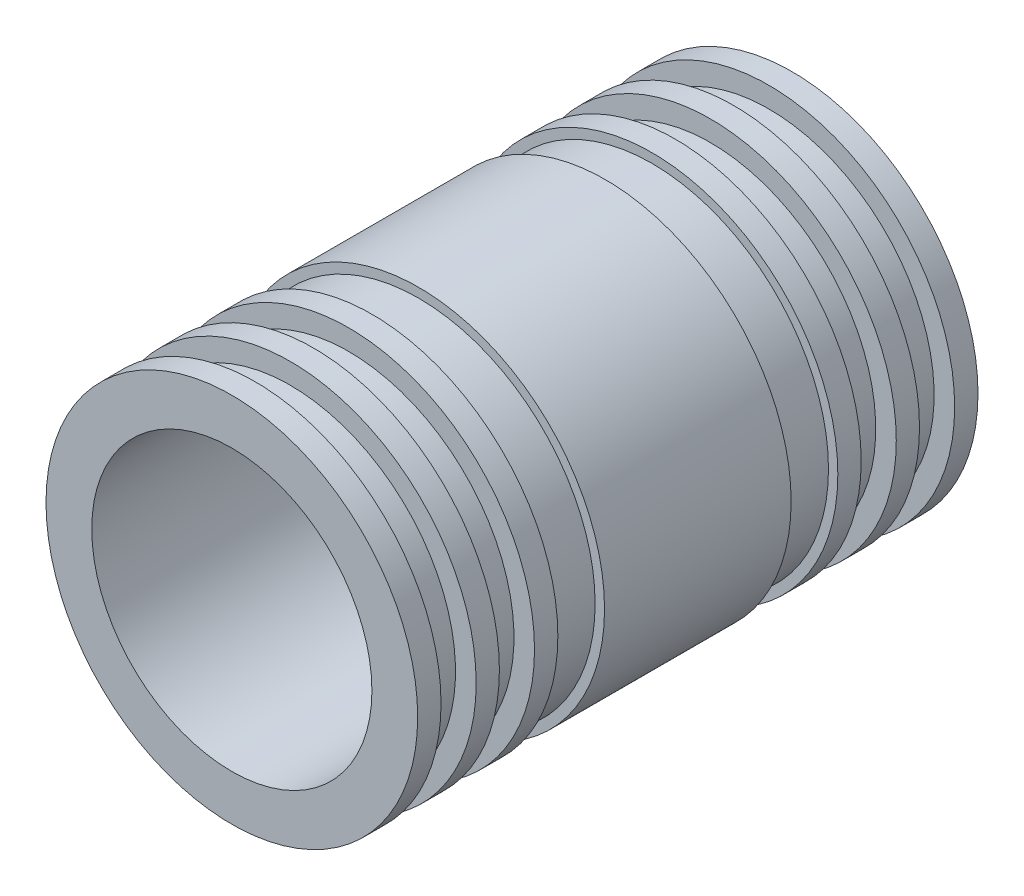
from build123d import *

# Parameters (mm, degrees)
SKETCH1_R           = 25.273
BOSS_EXTRUDE1_DEPTH = 76.2
SKETCH5_R           = 19.05
CUT_EXTRUDE2_DEPTH  = 76.2


with BuildPart() as part:
    # Sketch1 → Boss-Extrude1 (new body)
    with BuildSketch(Plane.XY):
        with Locations(Location((0, 0, 0), (0, 0, 180))):
            Circle(SKETCH1_R)
    extrude(amount=BOSS_EXTRUDE1_DEPTH)

    # Sketch5 → Cut-Extrude2 (cut)
    with BuildSketch(Plane.XY.offset(76.2)):
        Circle(SKETCH5_R)
    extrude(amount=-CUT_EXTRUDE2_DEPTH, mode=Mode.SUBTRACT)

    # Cut-Sweep4: sweep along a path in groove path
    with BuildLine(Plane.XY.offset(60.3123)) as cut_sweep4_path:
        CenterArc((0, 0), 25.273, 0, 360)
    # Groove → Cut-Sweep4 (sweep, cut)
    with BuildSketch(Plane(origin=(0, 0, 0), x_dir=(0, 0, -1), z_dir=(1, 0, 0))):
        Polygon((-73.025, 25.273), (-73.025, 22.479), (-68.2625, 22.479), (-68.244704377, 25.273), (-65.0875, 25.273), (-65.0875, 22.479), (-60.3123, 22.479), (-60.3123, 25.273), (-57.1373, 25.273), (-57.1373, 24.003), (-50.8, 24.003), (-50.7873, 25.273), (-50.7873, 27.723939067), (-73.025, 27.723939067), align=None)
        Polygon((-3.175, 27.723939067), (-3.175, 25.273), (-3.175, 22.479), (-7.9375, 22.479), (-7.955295623, 25.273), (-11.1125, 25.273), (-11.1125, 22.479), (-15.8877, 22.479), (-15.8877, 25.273), (-19.0627, 25.273), (-19.0627, 24.003), (-25.4, 24.003), (-25.4127, 25.273), (-25.4127, 27.723939067), align=None)
    sweep(path=cut_sweep4_path.line, mode=Mode.SUBTRACT)


solid = part.part
